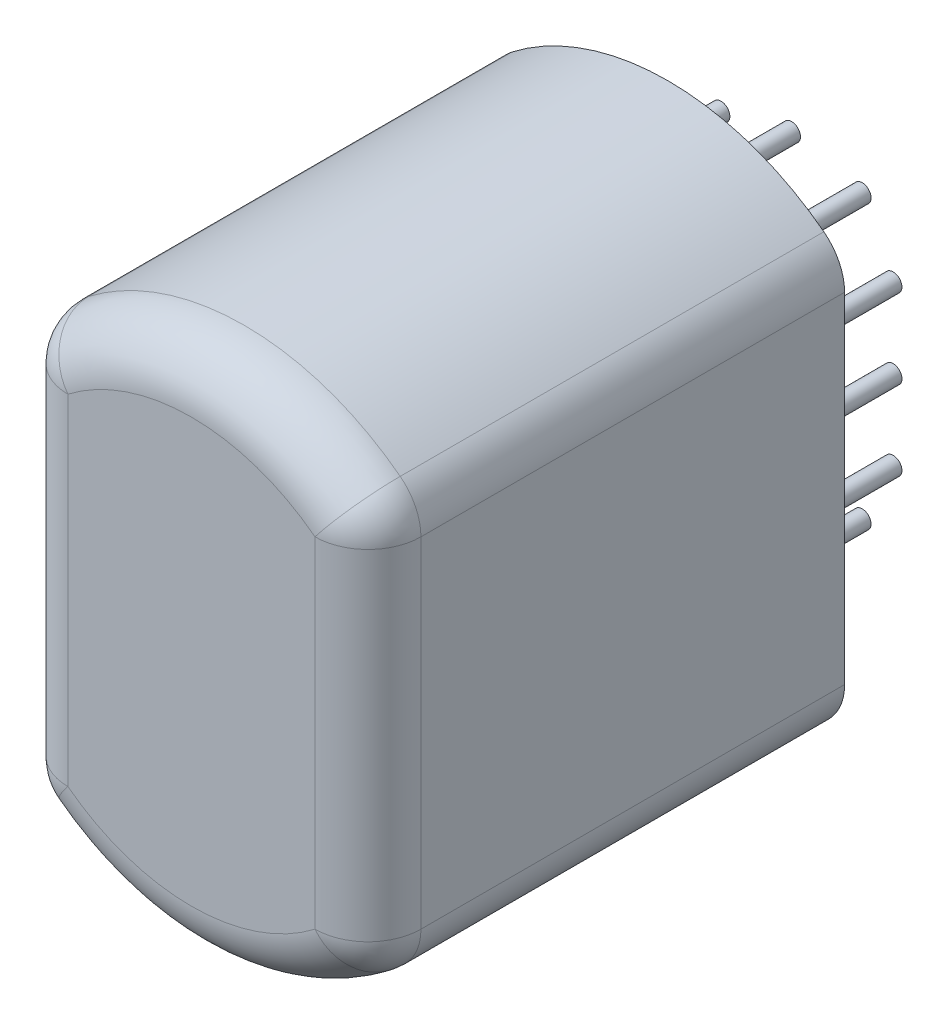
from build123d import *

# Parameters (mm, degrees)
BOSS_EXTRUDE1_DEPTH   = 27
FILLET1_R             = 3
FILLET2_R             = 3
SKETCH3_R             = 1.75
BOSS_EXTRUDE2_DEPTH   = 7
SKETCH4_R             = 0.5
BOSS_EXTRUDE3_DEPTH   = 7
BOSS_EXTRUDE3_2_DEPTH = 7
BOSS_EXTRUDE3_3_DEPTH = 7
BOSS_EXTRUDE3_4_DEPTH = 7


with BuildPart() as part:
    # Sketch1 → Boss-Extrude1 (new body)
    with BuildSketch(Plane.XY):
        with BuildLine():
            Line((-10, -11), (-10, 11))
            ThreePointArc((-10, 11), (0, 15), (10, 11))
            Line((10, 11), (10, -11))
            ThreePointArc((10, -11), (0, -15), (-10, -11))
        make_face()
    extrude(amount=BOSS_EXTRUDE1_DEPTH)

    # Fillet1
    fillet1_edges = [part.edges().sort_by_distance(p)[0] for p in [
        (10, 11, 13.5),
        (10, -11, 13.5),
        (-10, -11, 13.5),
        (-10, 11, 13.5),
    ]]
    fillet(fillet1_edges, radius=FILLET1_R)

    # Fillet2
    fillet2_edges = [part.edges().sort_by_distance(p)[0] for p in [
        (10, 0, 27),
        (0, -15, 27),
        (0, 15, 27),
        (-10, 0, 27),
        (9.690563219, 10.951121401, 27),
        (-9.690563219, 10.951121401, 27),
        (-9.690563219, -10.951121401, 27),
        (9.690563219, -10.951121401, 27),
    ]]
    fillet(fillet2_edges, radius=FILLET2_R)

    # Sketch3 → Boss-Extrude2 (add)
    with BuildSketch(Plane(origin=(0, 0, 0), x_dir=(-1, 0, 0), z_dir=(0, 0, -1))):
        Circle(SKETCH3_R)
    extrude(amount=BOSS_EXTRUDE2_DEPTH)


with BuildPart() as body_2:
    # Sketch4 → Boss-Extrude3 (new body)
    with BuildSketch(Plane(origin=(0, 0, 0), x_dir=(-1, 0, 0), z_dir=(0, 0, -1))):
        with Locations((-5.75, 0)):
            Circle(SKETCH4_R)
    extrude(amount=BOSS_EXTRUDE3_DEPTH)


with BuildPart() as body_3:
    # Sketch4 → Boss-Extrude3 2 (new body)
    with BuildSketch(Plane(origin=(0, 0, 0), x_dir=(-1, 0, 0), z_dir=(0, 0, -1))):
        with Locations((-5.75, 4.5)):
            Circle(SKETCH4_R)
    extrude(amount=BOSS_EXTRUDE3_2_DEPTH)


with BuildPart() as body_4:
    # Sketch4 → Boss-Extrude3 3 (new body)
    with BuildSketch(Plane(origin=(0, 0, 0), x_dir=(-1, 0, 0), z_dir=(0, 0, -1))):
        with Locations((-4, 8)):
            Circle(SKETCH4_R)
    extrude(amount=BOSS_EXTRUDE3_3_DEPTH)


with BuildPart() as body_5:
    # Sketch4 → Boss-Extrude3 4 (new body)
    with BuildSketch(Plane(origin=(0, 0, 0), x_dir=(-1, 0, 0), z_dir=(0, 0, -1))):
        with Locations((0, 9)):
            Circle(SKETCH4_R)
    extrude(amount=BOSS_EXTRUDE3_4_DEPTH)


with BuildPart() as body_6:
    # Mirror1: mirrored copy
    add(body_4.part.mirror(Plane(origin=(0, 0, 0), x_dir=(0, 0, 1), z_dir=(1, 0, 0))))


with BuildPart() as body_7:
    # Mirror1 2: mirrored copy
    add(body_3.part.mirror(Plane(origin=(0, 0, 0), x_dir=(0, 0, 1), z_dir=(1, 0, 0))))


with BuildPart() as body_8:
    # Mirror1 3: mirrored copy
    add(body_2.part.mirror(Plane(origin=(0, 0, 0), x_dir=(0, 0, 1), z_dir=(1, 0, 0))))


with BuildPart() as body_9:
    # Mirror2: mirrored copy
    add(body_3.part.mirror(Plane.ZX))


with BuildPart() as body_10:
    # Mirror2 2: mirrored copy
    add(body_4.part.mirror(Plane.ZX))


with BuildPart() as body_11:
    # Mirror2 3: mirrored copy
    add(body_5.part.mirror(Plane.ZX))


with BuildPart() as body_12:
    # Mirror2 4: mirrored copy
    add(body_6.part.mirror(Plane.ZX))


with BuildPart() as body_13:
    # Mirror2 5: mirrored copy
    add(body_7.part.mirror(Plane.ZX))


with BuildPart() as body_2_1:
    add(body_2.part)

    # Combine1: union body 5, body 7, body 9, body 13, body 3, body 6, body 12, body 4, body 11, body 8, body 10, part
    add(body_5.part)
    add(body_7.part)
    add(body_9.part)
    add(body_13.part)
    add(body_3.part)
    add(body_6.part)
    add(body_12.part)
    add(body_4.part)
    add(body_11.part)
    add(body_8.part)
    add(body_10.part)
    add(part.part)


solid = body_2_1.part
